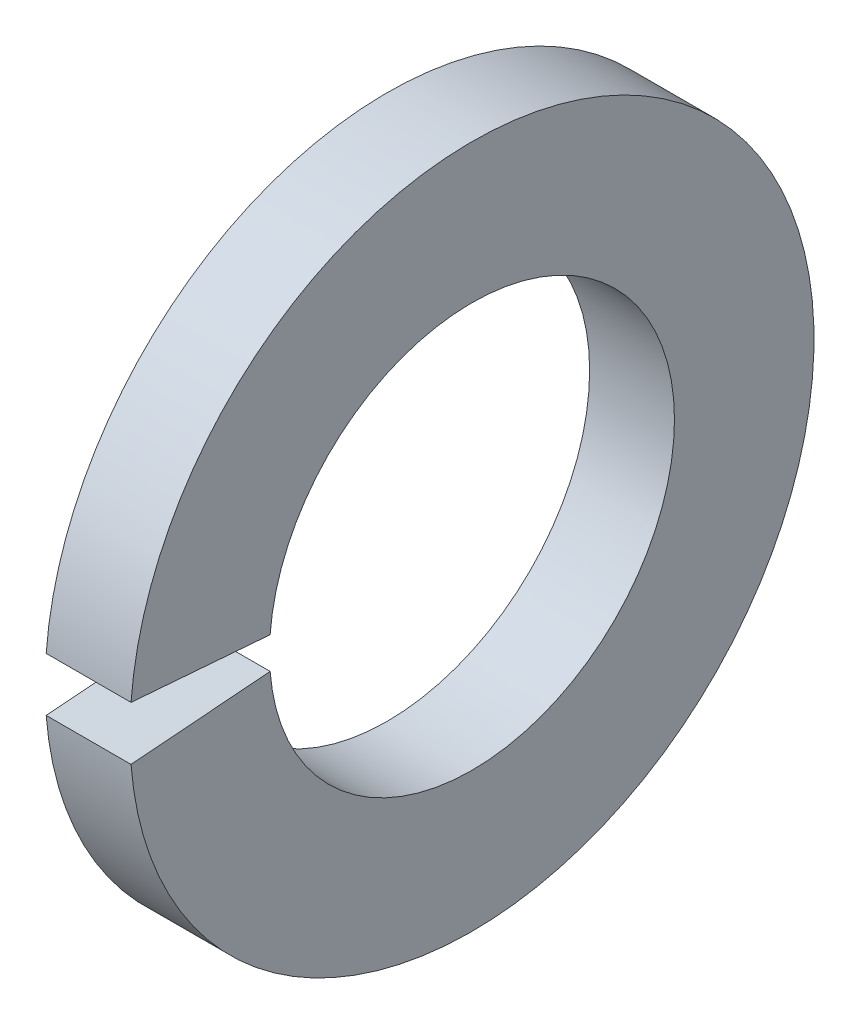
from build123d import *

# Parameters (mm, degrees)
SKETCH1_W      = 0.7874
SKETCH1_H      = 1.2954
REVOLVE1_ANGLE = 351


with BuildPart() as part:
    # Sketch1 → Revolve1 (revolve)
    with BuildSketch(Plane(origin=(0, 0, 0), x_dir=(-1, 0, 0), z_dir=(0, 0.996917333733128, 0.07845909572784564))):
        with Locations((0.3937, 2.5273)):
            Rectangle(SKETCH1_W, SKETCH1_H)
    revolve(axis=Axis((0, 0, 0), (1, 0, 0)), revolution_arc=REVOLVE1_ANGLE)


solid = part.part
